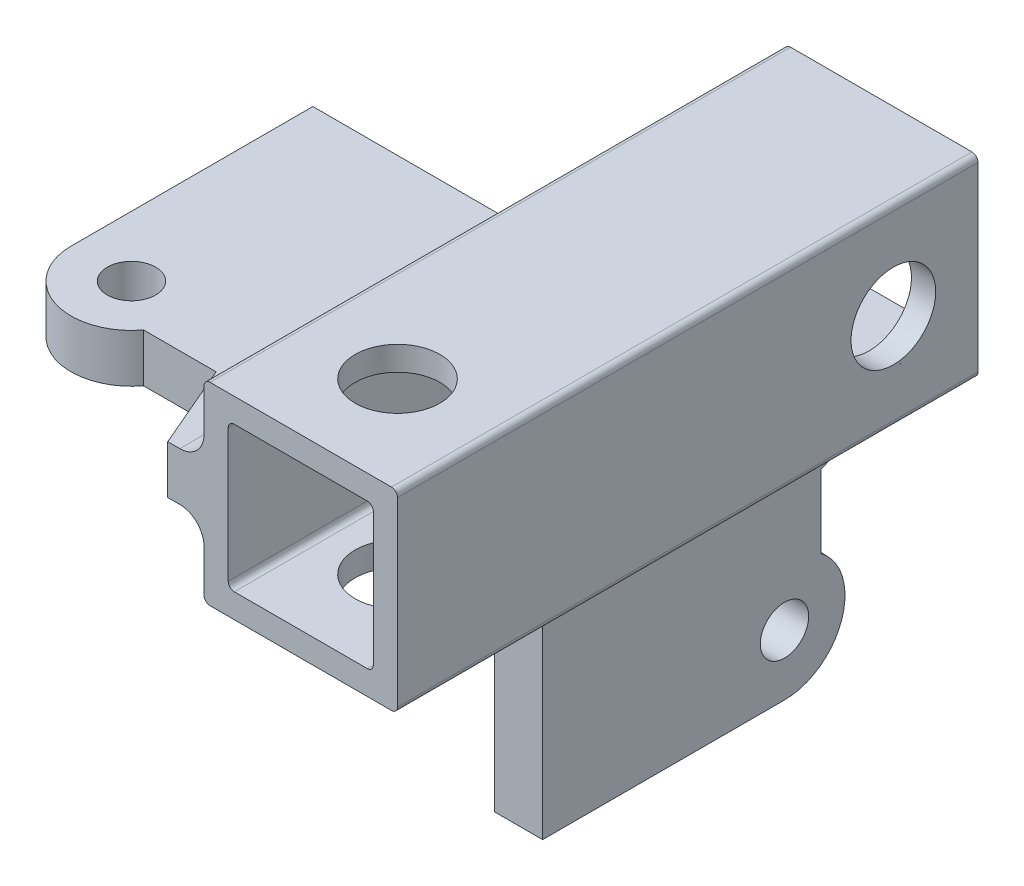
from build123d import *

# Parameters (mm, degrees)
SKETCH1_W          = 101.6
SKETCH1_H          = 101.6
SKETCH1_W_2        = 76.2
SKETCH1_H_2        = 76.2
EXTRUDE1_DEPTH     = 304.8
FILLET1_R          = 3.175
SKETCH2_R          = 22.225
CUT_EXTRUDE1_DEPTH = 326.278711262
SKETCH3_R          = 12.7
EXTRUDE2_DEPTH     = 12.7
SKETCH6_R          = 12.7
EXTRUDE3_DEPTH     = 12.7
SKETCH7_R          = 22.225
CUT_EXTRUDE2_DEPTH = 427.633056619
FILLET2_R          = 12.7


with BuildPart() as part:
    # Sketch1 → Extrude1 (new body)
    with BuildSketch(Plane.XY):
        Rectangle(SKETCH1_W, SKETCH1_H)
        Rectangle(SKETCH1_W_2, SKETCH1_H_2, mode=Mode.SUBTRACT)
    extrude(amount=EXTRUDE1_DEPTH)

    # Fillet1
    fillet1_edges = [part.edges().sort_by_distance(p)[0] for p in [
        (-38.1, 38.1, 152.4),
        (-38.1, -38.1, 152.4),
        (38.1, -38.1, 152.4),
        (38.1, 38.1, 152.4),
        (-50.8, 50.8, 152.4),
        (50.8, 50.8, 152.4),
        (50.8, -50.8, 152.4),
        (-50.8, -50.8, 152.4),
    ]]
    fillet(fillet1_edges, radius=FILLET1_R)

    # Sketch2 → Cut-Extrude1 (cut, through all)
    with BuildSketch(Plane(origin=(50.8, 0, 0), x_dir=(0, 0, -1), z_dir=(1, 0, 0))):
        with Locations((-44.45, 0)):
            Circle(SKETCH2_R)
    extrude(amount=-CUT_EXTRUDE1_DEPTH, mode=Mode.SUBTRACT)

    # Sketch3 → Extrude2 (add, symmetric)
    with BuildSketch(Plane(origin=(0, 0, 0), x_dir=(1, 0, 0), z_dir=(0, 1, 0))):
        with BuildLine():
            Line((-50.8, -304.8), (-69.85, -304.8))
            Line((-69.85, -304.8), (-88.9, -260.35))
            Line((-88.9, -260.35), (-127, -260.35))
            ThreePointArc((-127, -260.35), (-162.440231571, -271.420694713), (-184.15, -241.3))
            Line((-184.15, -241.3), (-184.15, -114.3))
            Line((-184.15, -114.3), (-50.8, -114.3))
            Line((-50.8, -114.3), (-50.8, -304.8))
        make_face()
        with Locations(Location((-152.4, -241.3, 0), (0, 0, 270))):
            Circle(SKETCH3_R, mode=Mode.SUBTRACT)
    extrude(amount=EXTRUDE2_DEPTH, both=True)

    # Sketch6 → Extrude3 (add, symmetric)
    with BuildSketch(Plane(origin=(0, 0, 0), x_dir=(0, 0, -1), z_dir=(1, 0, 0))):
        with BuildLine():
            Line((-190.5, -50.8), (-190.5, -184.15))
            Line((-190.5, -184.15), (-63.5, -184.15))
            ThreePointArc((-63.5, -184.15), (-33.379305287, -162.440231571), (-44.45, -127))
            Line((-44.45, -127), (-44.45, -88.9))
            Line((-44.45, -88.9), (0, -69.85))
            Line((0, -69.85), (0, -50.8))
            Line((0, -50.8), (-190.5, -50.8))
        make_face()
        with Locations((-63.5, -152.4)):
            Circle(SKETCH6_R, mode=Mode.SUBTRACT)
    extrude(amount=EXTRUDE3_DEPTH, both=True)

    # Sketch7 → Cut-Extrude2 (cut, through all)
    with BuildSketch(Plane(origin=(0, 50.8, 0), x_dir=(-1, 0, 0), z_dir=(0, 1, 0))):
        with Locations(Location((0, 254, 0), (0, 0, 90))):
            Circle(SKETCH7_R)
    extrude(amount=-CUT_EXTRUDE2_DEPTH, mode=Mode.SUBTRACT)

    # Fillet2
    fillet2_edges = [part.edges().sort_by_distance(p)[0] for p in [
        (12.7, -50.8, 95.25),
        (-12.7, -50.8, 95.25),
        (0, -50.8, 190.5),
        (-50.8, 12.7, 209.55),
        (-50.8, -12.7, 209.55),
        (-50.8, 0, 114.3),
    ]]
    fillet(fillet2_edges, radius=FILLET2_R)


solid = part.part
